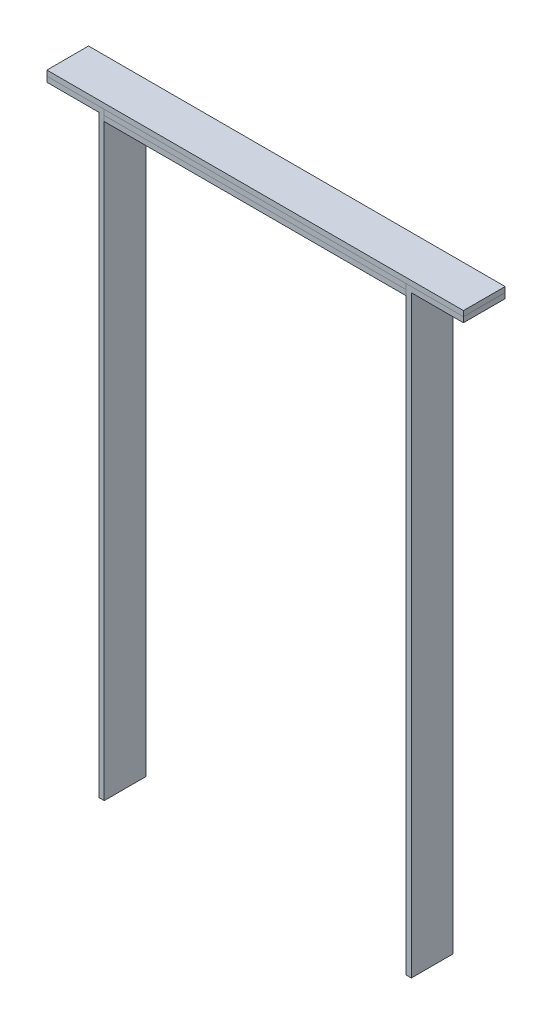
from build123d import *

# Parameters (mm, degrees)
BOSS_EXTRUDE1_DEPTH   = 10
BOSS_EXTRUDE1_2_DEPTH = 10
SKETCH2_4_W           = 72.46
SKETCH2_4_H           = 1.27
BOSS_EXTRUDE2_DEPTH   = 10
BOSS_EXTRUDE3_DEPTH   = 10
SKETCH2_7_W           = 72.46
SKETCH2_7_H           = 1.27
BOSS_EXTRUDE4_DEPTH   = 10


with BuildPart() as part:
    # Sketch2 → Boss-Extrude1 (new body)
    with BuildSketch(Plane.XY):
        Polygon((0, 142.46), (0, 0), (1.27, 0), (1.27, 143.73), (-12.5, 143.73), (-12.5, 142.46), align=None)
    extrude(amount=BOSS_EXTRUDE1_DEPTH)


with BuildPart() as body_2:
    # Sketch2 → Boss-Extrude1 2 (new body)
    with BuildSketch(Plane.XY):
        Polygon((73.73, 143.73), (73.73, 0), (75, 0), (75, 142.46), (87.5, 142.46), (87.5, 143.73), align=None)
    extrude(amount=BOSS_EXTRUDE1_2_DEPTH)


with BuildPart() as body_3:
    # Sketch2<4> → Boss-Extrude2 (new body)
    with BuildSketch(Plane.XY):
        with Locations((37.5, 143.095)):
            Rectangle(SKETCH2_4_W, SKETCH2_4_H)
    extrude(amount=BOSS_EXTRUDE2_DEPTH)


with BuildPart() as body_4:
    # Sketch2<5> → Boss-Extrude3 (new body)
    with BuildSketch(Plane.XY):
        Polygon((-12.5, 145), (-12.5, 143.73), (1.27, 143.73), (73.73, 143.73), (87.5, 143.73), (87.5, 145), align=None)
    extrude(amount=BOSS_EXTRUDE3_DEPTH)


with BuildPart() as body_5:
    # Sketch2<7> → Boss-Extrude4 (new body)
    with BuildSketch(Plane.XY):
        with Locations((37.5, 141.825)):
            Rectangle(SKETCH2_7_W, SKETCH2_7_H)
    extrude(amount=BOSS_EXTRUDE4_DEPTH)


solid = Compound([part.part, body_2.part, body_3.part, body_4.part, body_5.part])
